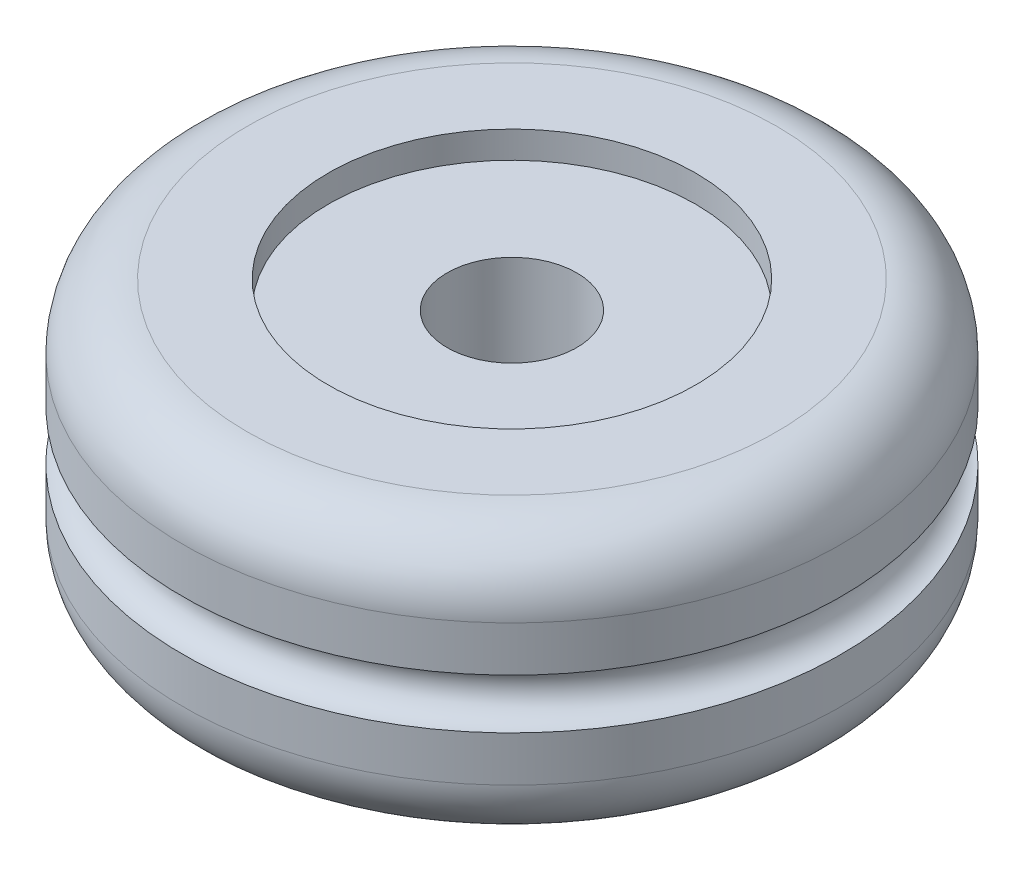
from build123d import *


with BuildPart() as part:
    # Эскиз1 → Повернуть1 (revolve)
    with BuildSketch(Plane.XY, mode=Mode.PRIVATE) as revolve_1_sk:
        with BuildLine():
            Line((17, 0), (24.5, 0))
            ThreePointArc((24.5, 0), (28.742640687, 1.757359313), (30.5, 6))
            Line((30.5, 6), (30.5, 10.186825835))
            ThreePointArc((30.5, 10.186825835), (28.186825835, 12.5), (30.5, 14.813174165))
            Line((30.5, 14.813174165), (30.5, 19))
            ThreePointArc((30.5, 19), (28.742640687, 23.242640687), (24.5, 25))
            Line((24.5, 25), (17, 25))
            Line((17, 25), (17, 22.5))
            Line((17, 22.5), (6, 22.5))
            Line((6, 22.5), (6, 2.5))
            Line((6, 2.5), (17, 2.5))
            Line((17, 2.5), (17, 0))
        make_face()
    revolve(revolve_1_sk.sketch.rotate(Axis((0, 26.126040174, 0), (0, 1, 0)), 90), axis=Axis((0, 26.126040174, 0), (0, 1, 0)))


solid = part.part
